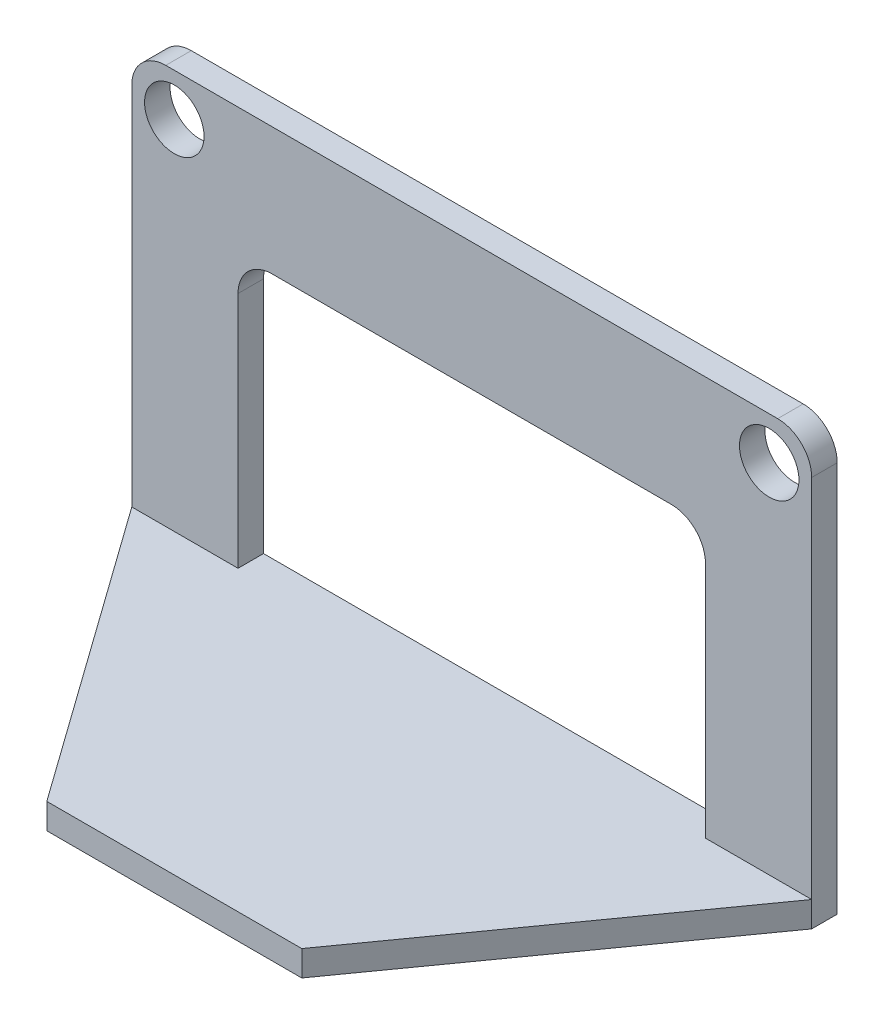
from build123d import *

# Parameters (mm, degrees)
SKETCH_1_R      = 3.5
EXTRUDE_1_DEPTH = 3
FILLET_1_R      = 4
FILLET_2_R      = 4
FILLET_3_R      = 4
FILLET_4_R      = 4
EXTRUDE_2_DEPTH = 3


with BuildPart() as part:
    # 草图1 → 凸台-拉伸1 (new body)
    with BuildSketch(Plane.XY):
        Polygon((0, 0), (80, 0), (80, -50), (67.5, -50), (67.5, -15), (12.5, -15), (12.5, -50), (0, -50), align=None)
        with Locations((5, -5)):
            Circle(SKETCH_1_R, mode=Mode.SUBTRACT)
        with Locations((75, -5)):
            Circle(SKETCH_1_R, mode=Mode.SUBTRACT)
    extrude(amount=EXTRUDE_1_DEPTH)

    # 圆角1
    fillet_1_edges = [part.edges().sort_by_distance(p)[0] for p in [
        (0, 0, 1.5),
    ]]
    fillet(fillet_1_edges, radius=FILLET_1_R)

    # 圆角2
    fillet_2_edges = [part.edges().sort_by_distance(p)[0] for p in [
        (80, 0, 1.5),
    ]]
    fillet(fillet_2_edges, radius=FILLET_2_R)

    # 圆角3
    fillet_3_edges = [part.edges().sort_by_distance(p)[0] for p in [
        (12.5, -15, 1.5),
    ]]
    fillet(fillet_3_edges, radius=FILLET_3_R)

    # 圆角4
    fillet_4_edges = [part.edges().sort_by_distance(p)[0] for p in [
        (67.5, -15, 1.5),
    ]]
    fillet(fillet_4_edges, radius=FILLET_4_R)

    # 草图2 → 凸台-拉伸2 (add)
    with BuildSketch(Plane.XZ.offset(50)):
        Polygon((0, 3), (25, 38), (55, 38), (80, 3), (80, 0), (0, 0), align=None)
    extrude(amount=-EXTRUDE_2_DEPTH)


solid = part.part
